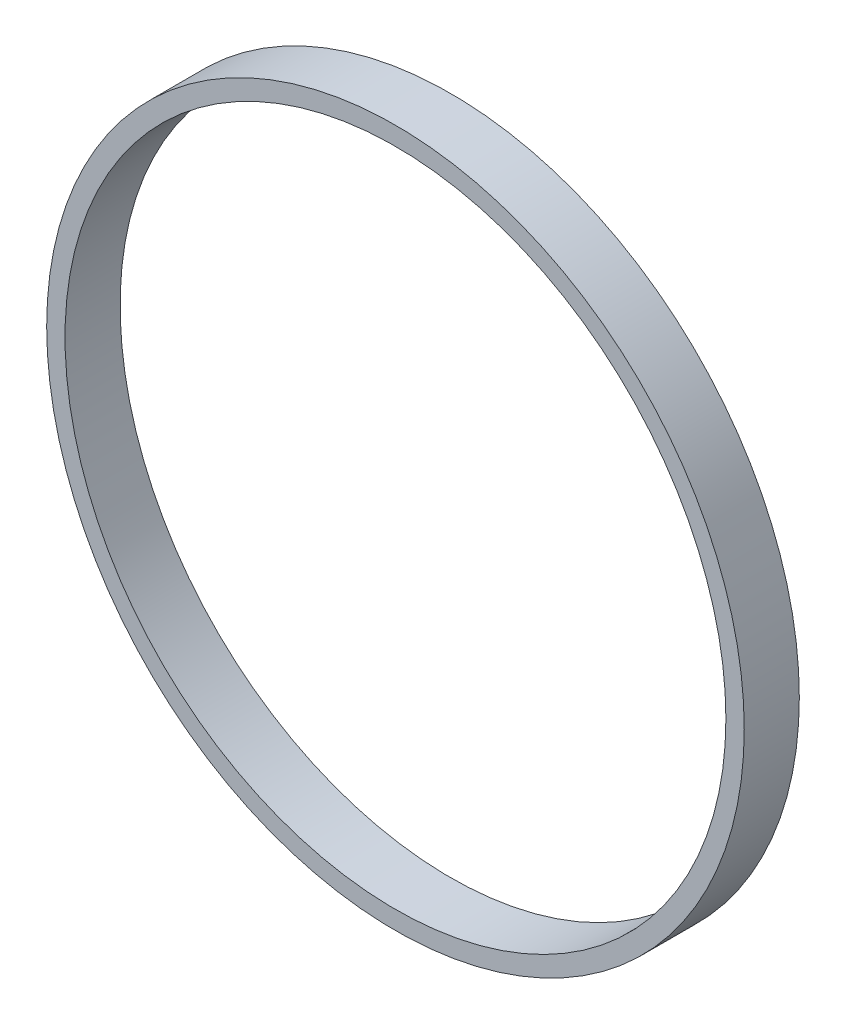
from build123d import *

# Parameters (mm, degrees)
SKETCH_1_R          = 4.75
EXTRUDE_1_DEPTH     = 0.75
SKETCH_3_R          = 4.5
CUT_EXTRUDE_1_DEPTH = 0.75


with BuildPart() as part:
    # 草图1 → 凸台-拉伸1 (new body)
    with BuildSketch(Plane.XY):
        Circle(SKETCH_1_R)
    extrude(amount=EXTRUDE_1_DEPTH)

    # 草图3 → 切除-拉伸1 (cut)
    with BuildSketch(Plane.XY.offset(0.75)):
        Circle(SKETCH_3_R)
    extrude(amount=-CUT_EXTRUDE_1_DEPTH, mode=Mode.SUBTRACT)


solid = part.part
